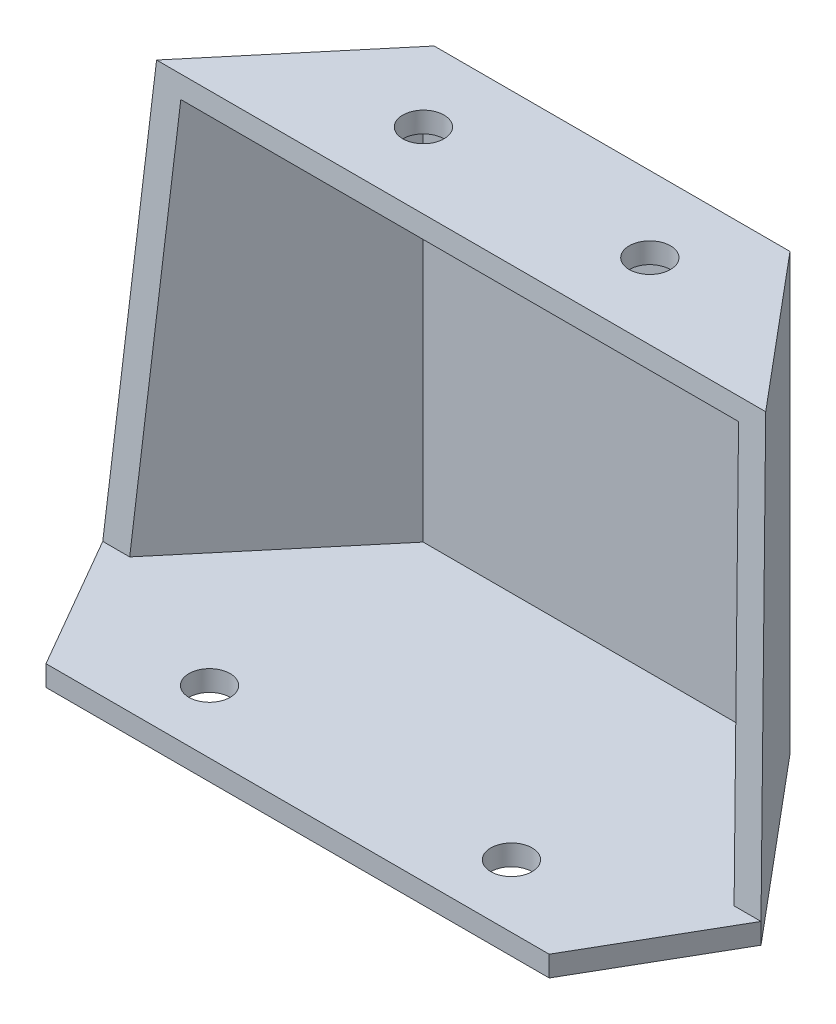
from build123d import *

# Parameters (mm, degrees)
EXTRUDE_1_DEPTH          = 211
SHELL_7_T                = 10
CUT_EXTRUDE_3_DEPTH      = 322.123948303
CUT_EXTRUDE_3_DEPTH_BACK = 322.123948303
CUT_EXTRUDE_4_REACH      = 323.124
SKETCH_7_R               = 10
CUT_EXTRUDE_5_REACH      = 316.644
SKETCH_8_R               = 10


with BuildPart() as part:
    # 草图1 → 凸台-拉伸1 (new body)
    with BuildSketch(Plane(origin=(0, 0, 0), x_dir=(1, 0, 0), z_dir=(0, 1, 0))):
        Polygon((-122, -182.016129032), (122, -182.016129032), (159.592352403, -116.904264694), (86.265, -29.516129032), (-86.265, -29.516129032), (-159.592352403, -116.904264694), align=None)
    extrude(amount=EXTRUDE_1_DEPTH)

    # 抽壳7 (no face opened: a closed hollow body)
    add(offset(amount=-SHELL_7_T, mode=Mode.PRIVATE), mode=Mode.SUBTRACT)

    # 草图4 → 切除-拉伸3 (cut, two sides: drawn at the far end of the back side and taken through both)
    with BuildSketch(Plane(origin=(0, 0, 0), x_dir=(0, 0, -1), z_dir=(1, 0, 0)).offset(-CUT_EXTRUDE_3_DEPTH_BACK)):
        Polygon((-102.716129032, 211), (-182.016129032, 211), (-182.016129032, 10), (-116.904264694, 10), align=None)
    extrude(amount=CUT_EXTRUDE_3_DEPTH + CUT_EXTRUDE_3_DEPTH_BACK, mode=Mode.SUBTRACT)

    # 草图7 → 切除-拉伸4 (cut, up to next)
    with BuildSketch(Plane(origin=(0, 211, 0), x_dir=(1, 0, 0), z_dir=(0, 1, 0)), mode=Mode.PRIVATE) as cut_extrude_4_sk1:
        with Locations(Location((-54.9, -66.116129032, 0), (0, 0, 270))):
            Circle(SKETCH_7_R)
    cut_extrude_4_tool1 = extrude(cut_extrude_4_sk1.sketch, amount=-CUT_EXTRUDE_4_REACH, mode=Mode.PRIVATE) & part.part
    # 草图7 → 切除-拉伸4 (cut, up to next)
    with BuildSketch(Plane(origin=(0, 211, 0), x_dir=(1, 0, 0), z_dir=(0, 1, 0)), mode=Mode.PRIVATE) as cut_extrude_4_sk2:
        with Locations(Location((54.9, -66.116129032, 0), (0, 0, 90))):
            Circle(SKETCH_7_R)
    cut_extrude_4_tool2 = extrude(cut_extrude_4_sk2.sketch, amount=-CUT_EXTRUDE_4_REACH, mode=Mode.PRIVATE) & part.part
    add(cut_extrude_4_tool1.solids().sort_by_distance((-54.9, 211, 66.116129))[0], mode=Mode.SUBTRACT)
    add(cut_extrude_4_tool2.solids().sort_by_distance((54.9, 211, 66.116129))[0], mode=Mode.SUBTRACT)

    # 草图8 → 切除-拉伸5 (cut, up to next)
    with BuildSketch(Plane(origin=(0, 10, 0), x_dir=(1, 0, 0), z_dir=(0, 1, 0)), mode=Mode.PRIVATE) as cut_extrude_5_sk1:
        with Locations(Location((-73.2, -151.516129032, 0), (0, 0, 270))):
            Circle(SKETCH_8_R)
    cut_extrude_5_tool1 = extrude(cut_extrude_5_sk1.sketch, amount=-CUT_EXTRUDE_5_REACH, mode=Mode.PRIVATE) & part.part
    # 草图8 → 切除-拉伸5 (cut, up to next)
    with BuildSketch(Plane(origin=(0, 10, 0), x_dir=(1, 0, 0), z_dir=(0, 1, 0)), mode=Mode.PRIVATE) as cut_extrude_5_sk2:
        with Locations(Location((73.2, -151.516129032, 0), (0, 0, 90))):
            Circle(SKETCH_8_R)
    cut_extrude_5_tool2 = extrude(cut_extrude_5_sk2.sketch, amount=-CUT_EXTRUDE_5_REACH, mode=Mode.PRIVATE) & part.part
    add(cut_extrude_5_tool1.solids().sort_by_distance((-73.2, 10, 151.516129))[0], mode=Mode.SUBTRACT)
    add(cut_extrude_5_tool2.solids().sort_by_distance((73.2, 10, 151.516129))[0], mode=Mode.SUBTRACT)


solid = part.part
